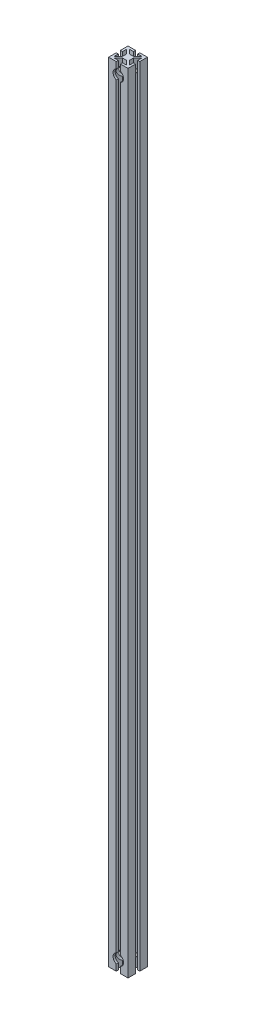
from build123d import *

# Parameters (mm, degrees)
BOSS_EXTRUDE1_DEPTH     = 1549.4
SKETCH3_R               = 10.287
CUT_EXTRUDE1_DEPTH      = 16.51
MIRROR2_COPY_1_SKETCH_R = 10.287
MIRROR2_COPY_1_DEPTH    = 16.51


with BuildPart() as part:
    # Sketch2 → Boss-Extrude1 (new body)
    with BuildSketch(Plane(origin=(0.594697292, 0, 0.594697292), x_dir=(1, 0, 0), z_dir=(0, 1, 0))):
        Polygon((-19.644697292, 19.644697292), (-4.658697292, 19.644697292), (-4.658697292, 15.580697292), (-12.707015333, 15.580697292), (-4.477415333, 7.351097292), (3.288020749, 7.351097292), (11.517620749, 15.580697292), (3.469302708, 15.580697292), (3.469302708, 19.644697292), (18.455302708, 19.644697292), (18.455302708, 4.658697292), (14.391302708, 4.658697292), (14.391302708, 12.707015333), (6.161702708, 4.477415333), (6.161702708, -3.288020749), (14.391302708, -11.517620749), (14.391302708, -3.469302708), (18.455302708, -3.469302708), (18.455302708, -18.455302708), (3.469302708, -18.455302708), (3.469302708, -14.391302708), (11.517620749, -14.391302708), (3.288020749, -6.161702708), (-4.477415333, -6.161702708), (-12.707015333, -14.391302708), (-4.658697292, -14.391302708), (-4.658697292, -18.455302708), (-19.644697292, -18.455302708), (-19.644697292, -3.469302708), (-15.580697292, -3.469302708), (-15.580697292, -11.517620749), (-7.351097292, -3.288020749), (-7.351097292, 4.477415333), (-15.580697292, 12.707015333), (-15.580697292, 4.658697292), (-19.644697292, 4.658697292), align=None)
    extrude(amount=BOSS_EXTRUDE1_DEPTH)

    # Sketch3 → Cut-Extrude1 (cut)
    with BuildSketch(Plane.XY.offset(19.05)):
        with Locations(Location((0, 21.844, 0), (0, 0, 48.944473627))):
            Circle(SKETCH3_R)
    cut_extrude1 = extrude(amount=-CUT_EXTRUDE1_DEPTH, mode=Mode.SUBTRACT)

    # Mirror1: Cut-Extrude1 across plane
    add(cut_extrude1.mirror(Plane.XY), mode=Mode.SUBTRACT)

    # Mirror2: Cut-Extrude1 across plane
    add(cut_extrude1.mirror(Plane(origin=(0, 774.7, 0), x_dir=(0, 0, 1), z_dir=(0, -1, 0))), mode=Mode.SUBTRACT)

    # Mirror2 copy 1 sketch → Mirror2 copy 1 (cut)
    with BuildSketch(Plane(origin=(0, 1549.4, -19.05), x_dir=(1, 0, 0), z_dir=(0, 0, -1))):
        with Locations(Location((0, 21.844, 0), (0, 0, 48.944473627))):
            Circle(MIRROR2_COPY_1_SKETCH_R)
    extrude(amount=-MIRROR2_COPY_1_DEPTH, mode=Mode.SUBTRACT)


solid = part.part
